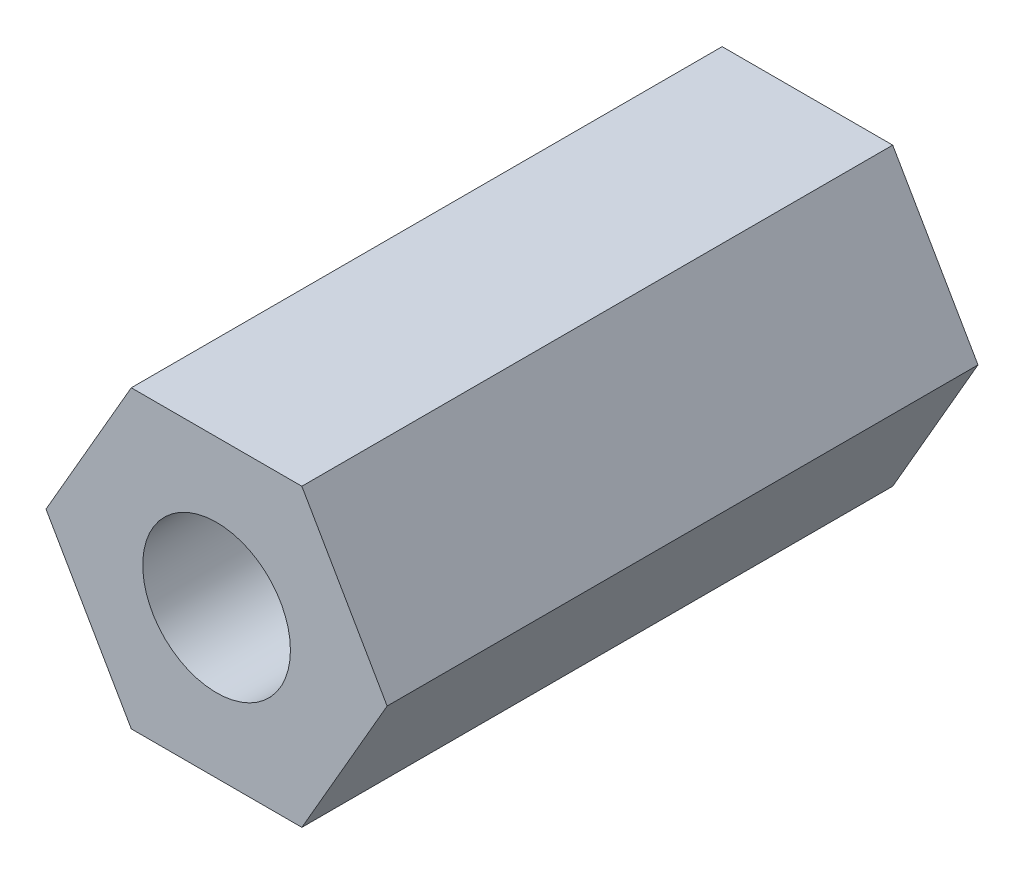
from build123d import *

# Parameters (mm, degrees)
SKETCH_1_R      = 1.5
EXTRUDE_1_DEPTH = 12


with BuildPart() as part:
    # 草图1 → 凸台-拉伸1 (new body)
    with BuildSketch(Plane.XY):
        Polygon((3.464101615, 0), (1.732050808, 3), (-1.732050808, 3), (-3.464101615, 0), (-1.732050808, -3), (1.732050808, -3), align=None)
        Circle(SKETCH_1_R, mode=Mode.SUBTRACT)
    extrude(amount=EXTRUDE_1_DEPTH)


solid = part.part
